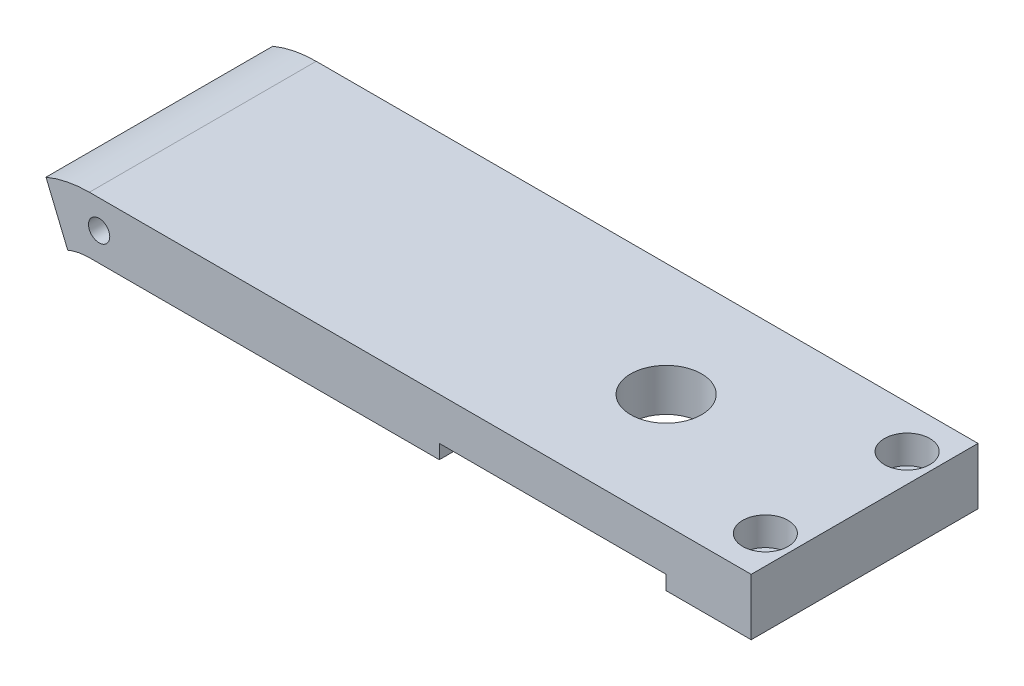
from build123d import *

# Parameters (mm, degrees)
EXTRUDE1_DEPTH     = 50.8
CUT_EXTRUDE1_DEPTH = 9.525
SKETCH3_R          = 7.9375
CUT_EXTRUDE2_DEPTH = 163.175685145
SKETCH4_W          = 50.8
SKETCH4_H          = 50.8
CUT_EXTRUDE3_DEPTH = 3.175
SKETCH5_R          = 2.38125
CUT_EXTRUDE4_DEPTH = 15.875
CUT_EXTRUDE5_START = -15.875
SKETCH6_R          = 2.38125
CUT_EXTRUDE5_DEPTH = 15.875
SKETCH7_R          = 3.175
CUT_EXTRUDE6_DEPTH = 163.175685145
SKETCH8_R          = 5.08
CUT_EXTRUDE7_DEPTH = 6.35
CUT_EXTRUDE8_DEPTH = 163.175685145
EXTRUDE2_DEPTH     = 50.8


with BuildPart() as part:
    # Sketch1 → Extrude1 (new body)
    with BuildSketch(Plane.XY):
        Polygon((0, 0), (-5.260512242, 12.7), (153.489487758, 12.7), (153.489487758, 0), align=None)
    extrude(amount=EXTRUDE1_DEPTH)

    # Sketch2 → Cut-Extrude1 (cut)
    with BuildSketch(Plane.XZ):
        with BuildLine():
            Line((19.05, 41.275), (63.5, 41.275))
            ThreePointArc((63.5, 41.275), (67.990128061, 39.415128061), (69.85, 34.925))
            Line((69.85, 34.925), (69.85, 15.875))
            ThreePointArc((69.85, 15.875), (67.990128061, 11.384871939), (63.5, 9.525))
            Line((63.5, 9.525), (19.05, 9.525))
            ThreePointArc((19.05, 9.525), (14.559871939, 11.384871939), (12.7, 15.875))
            Line((12.7, 15.875), (12.7, 34.925))
            ThreePointArc((12.7, 34.925), (14.559871939, 39.415128061), (19.05, 41.275))
        make_face()
    extrude(amount=-CUT_EXTRUDE1_DEPTH, mode=Mode.SUBTRACT)

    # Sketch3 → Cut-Extrude2 (cut, through all)
    with BuildSketch(Plane.XZ):
        with Locations((109.039487758, 25.4)):
            Circle(SKETCH3_R)
    extrude(amount=-CUT_EXTRUDE2_DEPTH, mode=Mode.SUBTRACT)

    # Sketch4 → Cut-Extrude3 (cut)
    with BuildSketch(Plane.XZ):
        with Locations((109.039487758, 25.4)):
            Rectangle(SKETCH4_W, SKETCH4_H)
    extrude(amount=-CUT_EXTRUDE3_DEPTH, mode=Mode.SUBTRACT)

    # Sketch5 → Cut-Extrude4 (cut)
    with BuildSketch(Plane.XY.offset(50.8)):
        with Locations((7.439487758, 6.35)):
            Circle(SKETCH5_R)
    extrude(amount=-CUT_EXTRUDE4_DEPTH, mode=Mode.SUBTRACT)

    # Sketch6 → Cut-Extrude5 (cut)
    with BuildSketch(Plane(origin=(0, 0, 0), x_dir=(-1, 0, 0), z_dir=(0, 0, -1)).offset(CUT_EXTRUDE5_START)):
        with Locations(Location((-7.439487758, 6.35, 0), (0, 0, 180))):
            Circle(SKETCH6_R)
    extrude(amount=CUT_EXTRUDE5_DEPTH, mode=Mode.SUBTRACT)

    # Sketch7 → Cut-Extrude6 (cut, through all)
    with BuildSketch(Plane(origin=(0, 12.7, 0), x_dir=(-1, 0, 0), z_dir=(0, 1, 0))):
        with Locations(Location((-147.139487758, 9.525, 0), (0, 0, 90))):
            Circle(SKETCH7_R)
        with Locations(Location((-147.139487758, 41.275, 0), (0, 0, 90))):
            Circle(SKETCH7_R)
    extrude(amount=-CUT_EXTRUDE6_DEPTH, mode=Mode.SUBTRACT)

    # Sketch8 → Cut-Extrude7 (cut)
    with BuildSketch(Plane(origin=(0, 12.7, 0), x_dir=(-1, 0, 0), z_dir=(0, 1, 0))):
        with Locations(Location((-147.139487758, 9.525, 0), (0, 0, 90))):
            Circle(SKETCH8_R)
        with Locations(Location((-147.139487758, 41.275, 0), (0, 0, 90))):
            Circle(SKETCH8_R)
    extrude(amount=-CUT_EXTRUDE7_DEPTH, mode=Mode.SUBTRACT)

    # Sketch9 → Cut-Extrude8 (cut, through all)
    with BuildSketch(Plane.XY.offset(50.8)):
        with BuildLine():
            Line((5.260512242, 12.7), (-5.260512242, 12.7))
            Line((-5.260512242, 12.7), (-4.45964694, 10.766540126))
            ThreePointArc((-4.45964694, 10.766540126), (0.305218063, 12.211946122), (5.260512242, 12.7))
        make_face()
    extrude(amount=-CUT_EXTRUDE8_DEPTH, mode=Mode.SUBTRACT)

    # Sketch10 → Extrude2 (add)
    with BuildSketch(Plane.XY.offset(50.8)):
        with BuildLine():
            Line((0, 0), (0.400432651, -0.966729937))
            ThreePointArc((0.400432651, -0.966729937), (2.782865153, -0.244026939), (5.260512242, 0))
            Line((5.260512242, 0), (0, 0))
        make_face()
    extrude(amount=-EXTRUDE2_DEPTH)


solid = part.part
